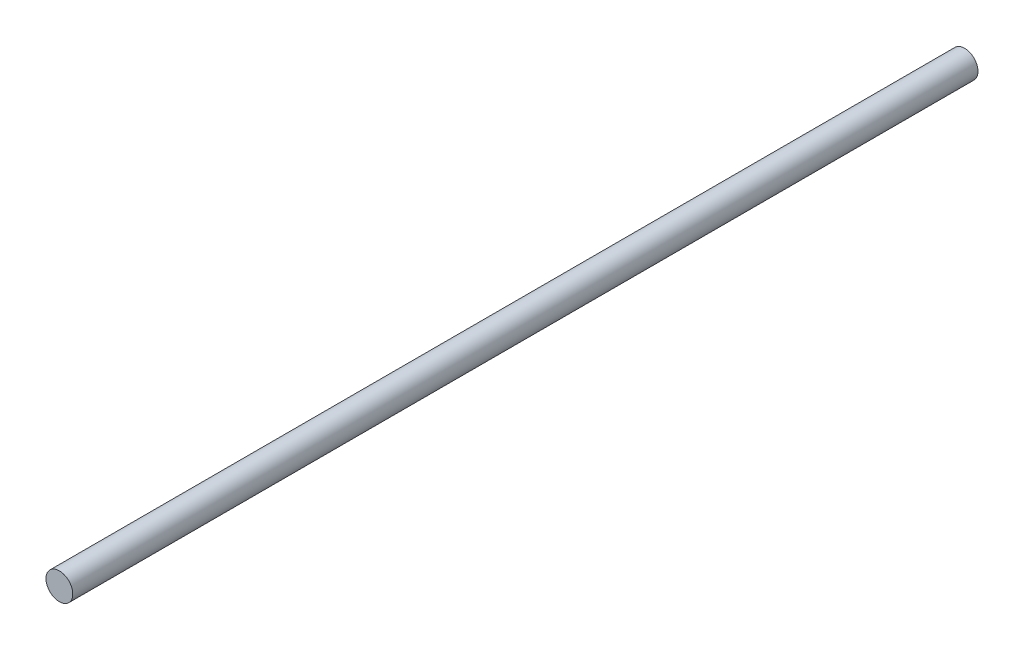
from build123d import *

# Parameters (mm, degrees)
SKETCH1_R           = 10
BOSS_EXTRUDE1_DEPTH = 338


with BuildPart() as part:
    # Sketch1 → Boss-Extrude1 (new, symmetric)
    with BuildSketch(Plane.XY):
        Circle(SKETCH1_R)
    extrude(amount=BOSS_EXTRUDE1_DEPTH, both=True)


solid = part.part
